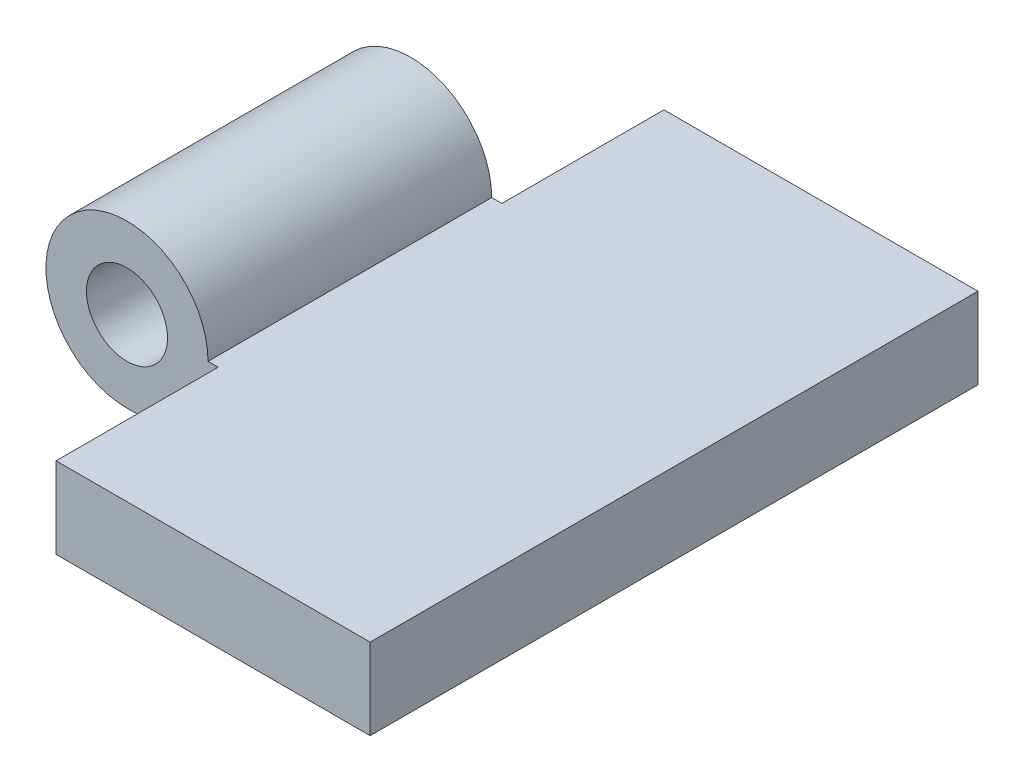
from build123d import *

# Parameters (mm, degrees)
EXTRUDE_1_DEPTH     = 30
SKETCH_2_W          = 9
SKETCH_2_H          = 8.937793365
SKETCH_2_H_2        = 10.067856953
CUT_EXTRUDE_1_DEPTH = 15
SKETCH_3_R          = 2
CUT_EXTRUDE_2_DEPTH = 32


with BuildPart() as part:
    # 草图1 → 凸台-拉伸1 (new body)
    with BuildSketch(Plane.XY):
        with BuildLine():
            Line((4, 0), (20, 0))
            Line((20, 0), (20, -4))
            Line((20, -4), (0, -4))
            ThreePointArc((0, -4), (-2.828427125, 2.828427125), (4, 0))
        make_face()
    extrude(amount=EXTRUDE_1_DEPTH)

    # 草图2 → 切除-拉伸1 (cut)
    with BuildSketch(Plane.XZ.offset(4)):
        with Locations((0, 26.468896683)):
            Rectangle(SKETCH_2_W, SKETCH_2_H)
        with Locations((0, 2.966071524)):
            Rectangle(SKETCH_2_W, SKETCH_2_H_2)
    extrude(amount=-CUT_EXTRUDE_1_DEPTH, mode=Mode.SUBTRACT)

    # 草图3 → 切除-拉伸2 (cut)
    with BuildSketch(Plane(origin=(0, 0, 0), x_dir=(-1, 0, 0), z_dir=(0, 0, -1))):
        Circle(SKETCH_3_R)
    extrude(amount=-CUT_EXTRUDE_2_DEPTH, mode=Mode.SUBTRACT)


solid = part.part
